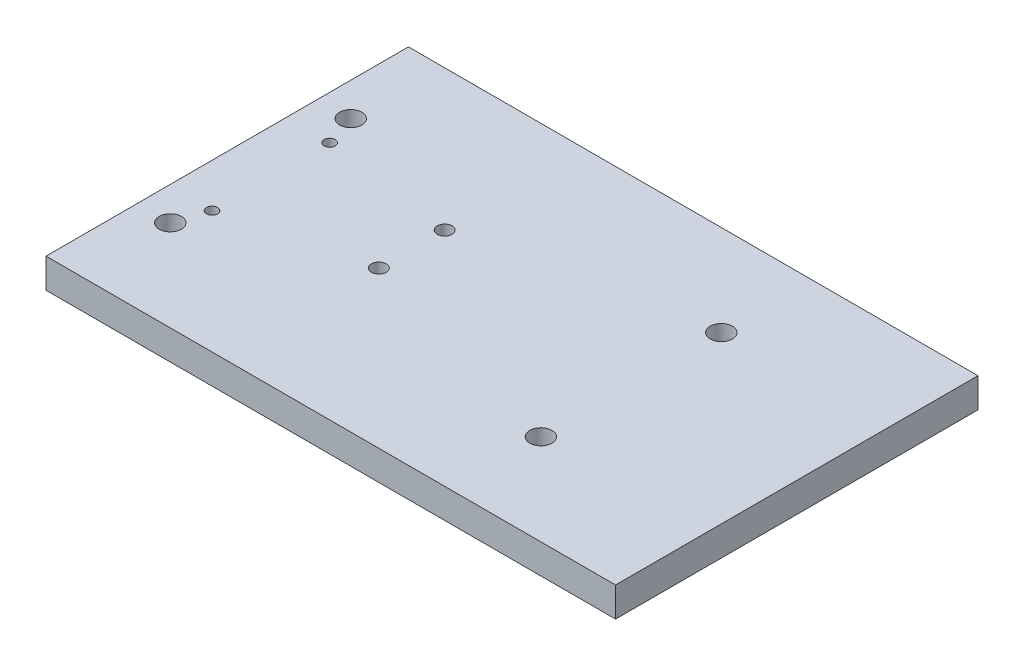
from build123d import *

# Parameters (mm, degrees)
SKETCH_1_W          = 77
SKETCH_1_H          = 49
EXTRUDE_1_DEPTH     = 4
SKETCH_2_R          = 1.5
SKETCH_2_R_2        = 0.75
SKETCH_2_R_3        = 1
CUT_EXTRUDE_2_DEPTH = 4


with BuildPart() as part:
    # 草图1 → 凸台-拉伸1 (new body)
    with BuildSketch(Plane(origin=(0, 0, 0), x_dir=(1, 0, 0), z_dir=(0, 1, 0))):
        Rectangle(SKETCH_1_W, SKETCH_1_H)
    extrude(amount=EXTRUDE_1_DEPTH)

    # 草图2 → 切除-拉伸2 (cut)
    with BuildSketch(Plane(origin=(0, 4, 0), x_dir=(1, 0, 0), z_dir=(0, 1, 0))):
        with Locations(Location((-34, -12.2, 0), (0, 0, 270))):
            Circle(SKETCH_2_R)
        with Locations(Location((16.1, -12.2, 0), (0, 0, 270))):
            Circle(SKETCH_2_R)
        with Locations(Location((16.1, 12.2, 0), (0, 0, 270))):
            Circle(SKETCH_2_R)
        with Locations(Location((-34, 12.2, 0), (0, 0, 270))):
            Circle(SKETCH_2_R)
        with Locations(Location((-32.6, 7.95, 0), (0, 0, 270))):
            Circle(SKETCH_2_R_2)
        with Locations(Location((-32.6, -7.95, 0), (0, 0, 270))):
            Circle(SKETCH_2_R_2)
        with Locations(Location((-14.6, -3.4, 0), (0, 0, 270))):
            Circle(SKETCH_2_R_3)
        with Locations(Location((-14.6, 5.5, 0), (0, 0, 270))):
            Circle(SKETCH_2_R_3)
    extrude(amount=-CUT_EXTRUDE_2_DEPTH, mode=Mode.SUBTRACT)


solid = part.part
